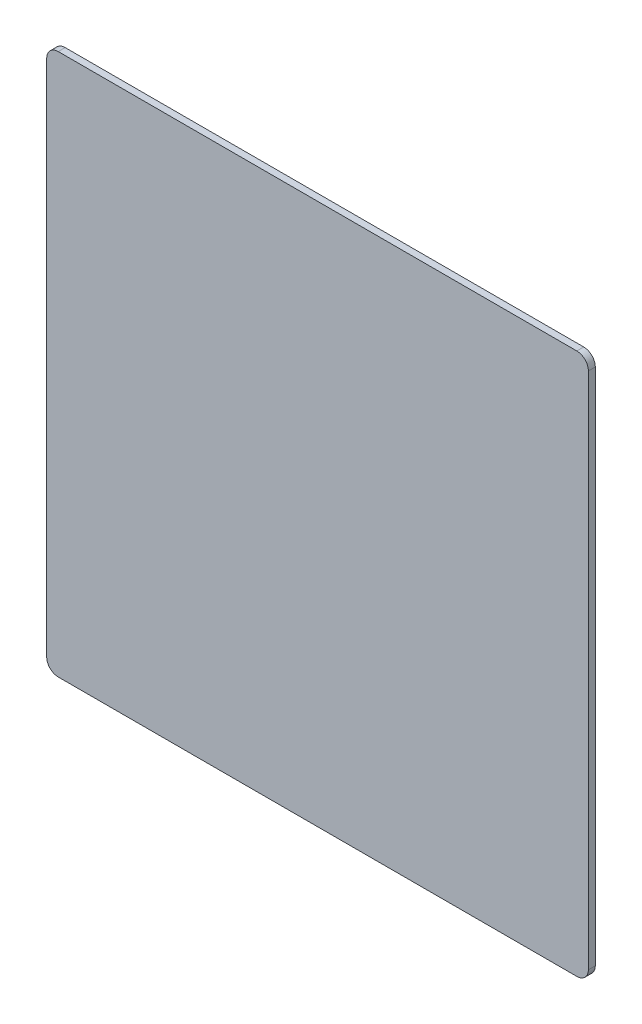
from build123d import *

# Parameters (mm, degrees)
BOSS_EXTRU_1_DEPTH = 3


with BuildPart() as part:
    # Esquisse1 → Boss.-Extru.1 (new body)
    with BuildSketch(Plane.XY):
        with BuildLine():
            Line((-117.5, 112.5), (-117.5, -112.5))
            ThreePointArc((-117.5, -112.5), (-116.035533906, -116.035533906), (-112.5, -117.5))
            Line((-112.5, -117.5), (112.5, -117.5))
            ThreePointArc((112.5, -117.5), (116.035533906, -116.035533906), (117.5, -112.5))
            Line((117.5, -112.5), (117.5, 112.5))
            ThreePointArc((117.5, 112.5), (116.035533906, 116.035533906), (112.5, 117.5))
            Line((112.5, 117.5), (-112.5, 117.5))
            ThreePointArc((-112.5, 117.5), (-116.035533906, 116.035533906), (-117.5, 112.5))
        make_face()
    extrude(amount=BOSS_EXTRU_1_DEPTH)


solid = part.part
